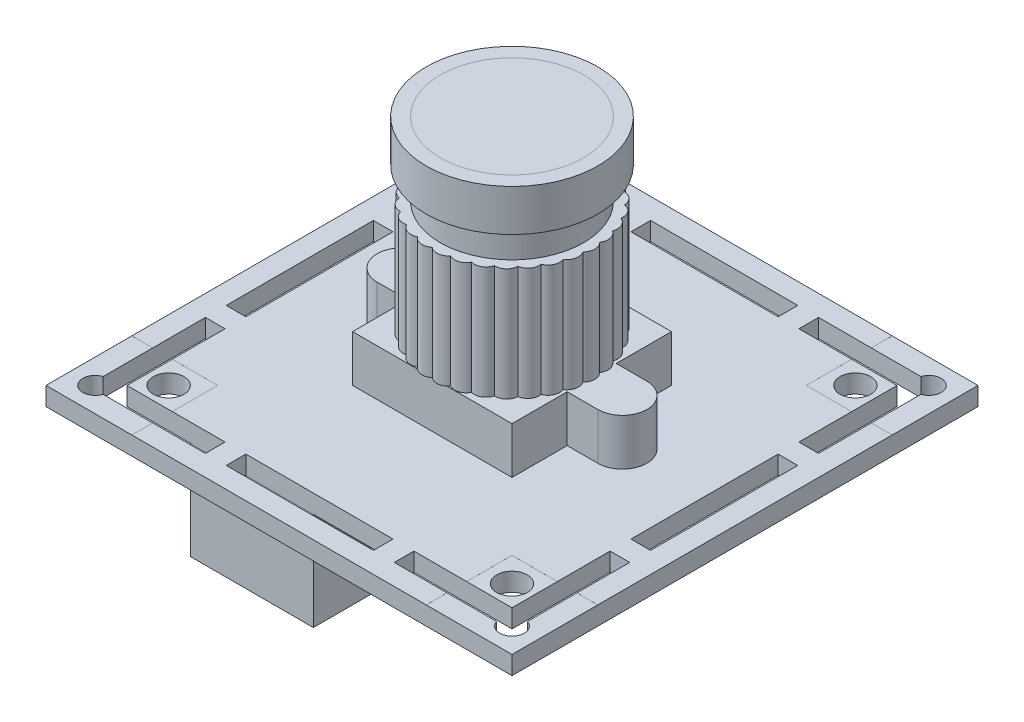
from build123d import *

# Parameters (mm, degrees)
SKETCH_1_W          = 38
SKETCH_1_H          = 38
SKETCH_1_R          = 1.25
SKETCH_1_R_2        = 1
EXTRUDE_1_DEPTH     = 1.5
SKETCH_9_W          = 7
SKETCH_9_H          = 7
CUT_EXTRUDE_2_DEPTH = 0.001
CUT_EXTRUDE_START   = -1.5
SKETCH_9_2_W        = 7
SKETCH_9_2_H        = 7
CUT_EXTRUDE_3_DEPTH = 0.001
CUT_EXTRUDE_1_DEPTH = 27.911893282
EXTRUDE_2_DEPTH     = 3.8
EXTRUDE_3_DEPTH     = 9.2
SKETCH_5_R          = 5.85
EXTRUDE_4_DEPTH     = 6
SKETCH_7_R          = 7
SKETCH_7_R_2        = 5.85
EXTRUDE_5_DEPTH     = 3.4
SKETCH_8_W          = 10
SKETCH_8_H          = 4.7
EXTRUDE_6_DEPTH     = 8


with BuildPart() as part:
    # 草图1 → 凸台-拉伸1 (new body)
    with BuildSketch(Plane(origin=(0, 0, 0), x_dir=(1, 0, 0), z_dir=(0, 1, 0))):
        Rectangle(SKETCH_1_W, SKETCH_1_H)
        with Locations(Location((-14, 14, 0), (0, 0, 270))):
            Circle(SKETCH_1_R, mode=Mode.SUBTRACT)
        with Locations(Location((-14, -14, 0), (0, 0, 270))):
            Circle(SKETCH_1_R, mode=Mode.SUBTRACT)
        with Locations(Location((14, 14, 0), (0, 0, 270))):
            Circle(SKETCH_1_R, mode=Mode.SUBTRACT)
        with Locations(Location((14, -14, 0), (0, 0, 270))):
            Circle(SKETCH_1_R, mode=Mode.SUBTRACT)
        with Locations(Location((-17, 17, 0), (0, 0, 270))):
            Circle(SKETCH_1_R_2, mode=Mode.SUBTRACT)
        with Locations(Location((-17, -17, 0), (0, 0, 270))):
            Circle(SKETCH_1_R_2, mode=Mode.SUBTRACT)
        with Locations(Location((17, -17, 0), (0, 0, 270))):
            Circle(SKETCH_1_R_2, mode=Mode.SUBTRACT)
        with Locations(Location((17, 17, 0), (0, 0, 270))):
            Circle(SKETCH_1_R_2, mode=Mode.SUBTRACT)
    extrude(amount=EXTRUDE_1_DEPTH)

    # 草图9 → 切除-拉伸2 (cut)
    with BuildSketch(Plane(origin=(0, 1.5, 0), x_dir=(1, 0, 0), z_dir=(0, 1, 0))):
        with Locations((15.5, 15.5)):
            Rectangle(SKETCH_9_W, SKETCH_9_H)
        with Locations((-15.5, 15.5)):
            Rectangle(SKETCH_9_W, SKETCH_9_H)
        with Locations((15.5, -15.5)):
            Rectangle(SKETCH_9_W, SKETCH_9_H)
        with Locations((-15.5, -15.5)):
            Rectangle(SKETCH_9_W, SKETCH_9_H)
    extrude(amount=-CUT_EXTRUDE_2_DEPTH, mode=Mode.SUBTRACT)

    # 草图9<2> → 切除-拉伸3 (cut)
    with BuildSketch(Plane(origin=(0, 1.5, 0), x_dir=(1, 0, 0), z_dir=(0, 1, 0)).offset(CUT_EXTRUDE_START)):
        with Locations((15.5, 15.5)):
            Rectangle(SKETCH_9_2_W, SKETCH_9_2_H)
        with Locations((-15.5, 15.5)):
            Rectangle(SKETCH_9_2_W, SKETCH_9_2_H)
        with Locations((15.5, -15.5)):
            Rectangle(SKETCH_9_2_W, SKETCH_9_2_H)
        with Locations((-15.5, -15.5)):
            Rectangle(SKETCH_9_2_W, SKETCH_9_2_H)
    extrude(amount=CUT_EXTRUDE_3_DEPTH, mode=Mode.SUBTRACT)

    # 草图2 → 切除-拉伸1 (cut, through all)
    with BuildSketch(Plane.XZ):
        Polygon((-17.3, 17.3), (-7.7, 17.3), (-7.7, 15.7), (-15.7, 15.7), (-15.7, 7.7), (-17.3, 7.7), align=None)
        Polygon((0, 17.3), (-6, 17.3), (-6, 15.7), (0, 15.7), (6, 15.7), (6, 17.3), align=None)
        Polygon((-15.7, 6), (-15.7, 0), (-15.7, -6), (-17.3, -6), (-17.3, 0), (-17.3, 6), align=None)
        Polygon((15.7, 7.7), (15.7, 15.7), (7.7, 15.7), (7.7, 17.3), (17.3, 17.3), (17.3, 7.7), align=None)
        Polygon((17.3, 6), (15.7, 6), (15.7, 0), (15.7, -6), (17.3, -6), (17.3, 0), align=None)
        Polygon((7.7, -15.7), (15.7, -15.7), (15.7, -7.7), (17.3, -7.7), (17.3, -17.3), (7.7, -17.3), align=None)
        Polygon((6, -17.3), (6, -15.7), (0, -15.7), (-6, -15.7), (-6, -17.3), (0, -17.3), align=None)
        Polygon((-15.7, -7.7), (-15.7, -15.7), (-7.7, -15.7), (-7.7, -17.3), (-17.3, -17.3), (-17.3, -7.7), align=None)
    extrude(amount=-CUT_EXTRUDE_1_DEPTH, mode=Mode.SUBTRACT)

    # 草图3 → 凸台-拉伸2 (add)
    with BuildSketch(Plane(origin=(0, 1.5, 0), x_dir=(1, 0, 0), z_dir=(0, 1, 0))):
        with BuildLine():
            Line((-6.5, 2), (-6.5, 6.5))
            Line((-6.5, 6.5), (6.5, 6.5))
            Line((6.5, 6.5), (6.5, 2))
            Line((6.5, 2), (9, 2))
            ThreePointArc((9, 2), (11, 0), (9, -2))
            Line((9, -2), (6.5, -2))
            Line((6.5, -2), (6.5, -6.5))
            Line((6.5, -6.5), (-6.5, -6.5))
            Line((-6.5, -6.5), (-6.5, -2))
            Line((-6.5, -2), (-9, -2))
            ThreePointArc((-9, -2), (-11, 0), (-9, 2))
            Line((-9, 2), (-6.5, 2))
        make_face()
    extrude(amount=EXTRUDE_2_DEPTH)

    # 草图4 → 凸台-拉伸3 (add)
    with BuildSketch(Plane(origin=(0, 5.3, 0), x_dir=(1, 0, 0), z_dir=(0, 1, 0))):
        with BuildLine():
            ThreePointArc((1.35142599, 6.357959405), (0.705567127, 6.713022794), (0, 6.5))
            ThreePointArc((0, 6.5), (-0.705567127, 6.713022794), (-1.35142599, 6.357959405))
            ThreePointArc((-1.35142599, 6.357959405), (-2.085864712, 6.419631485), (-2.64378818, 5.938045475))
            ThreePointArc((-2.64378818, 5.938045475), (-3.375, 5.845671476), (-3.82060414, 5.258610463))
            ThreePointArc((-3.82060414, 5.258610463), (-4.516631593, 5.016227572), (-4.830441366, 4.349348941))
            ThreePointArc((-4.830441366, 4.349348941), (-5.460864712, 3.967550453), (-5.629165125, 3.25))
            ThreePointArc((-5.629165125, 3.25), (-6.166431839, 2.745472341), (-6.181867356, 2.008610463))
            ThreePointArc((-6.181867356, 2.008610463), (-6.602496305, 1.403403913), (-6.46439232, 0.679435011))
            ThreePointArc((-6.46439232, 0.679435011), (-6.75, 0), (-6.46439232, -0.679435011))
            ThreePointArc((-6.46439232, -0.679435011), (-6.602496305, -1.403403913), (-6.181867356, -2.008610463))
            ThreePointArc((-6.181867356, -2.008610463), (-6.166431839, -2.745472341), (-5.629165125, -3.25))
            ThreePointArc((-5.629165125, -3.25), (-5.460864712, -3.967550453), (-4.830441366, -4.349348941))
            ThreePointArc((-4.830441366, -4.349348941), (-4.516631593, -5.016227572), (-3.82060414, -5.258610463))
            ThreePointArc((-3.82060414, -5.258610463), (-3.375, -5.845671476), (-2.64378818, -5.938045475))
            ThreePointArc((-2.64378818, -5.938045475), (-2.085864712, -6.419631485), (-1.35142599, -6.357959405))
            ThreePointArc((-1.35142599, -6.357959405), (-0.705567127, -6.713022794), (0, -6.5))
            ThreePointArc((0, -6.5), (0.705567127, -6.713022794), (1.35142599, -6.357959405))
            ThreePointArc((1.35142599, -6.357959405), (2.085864712, -6.419631485), (2.64378818, -5.938045475))
            ThreePointArc((2.64378818, -5.938045475), (3.375, -5.845671476), (3.82060414, -5.258610463))
            ThreePointArc((3.82060414, -5.258610463), (4.516631593, -5.016227572), (4.830441366, -4.349348941))
            ThreePointArc((4.830441366, -4.349348941), (5.460864712, -3.967550453), (5.629165125, -3.25))
            ThreePointArc((5.629165125, -3.25), (6.166431839, -2.745472341), (6.181867356, -2.008610463))
            ThreePointArc((6.181867356, -2.008610463), (6.602496305, -1.403403913), (6.46439232, -0.679435011))
            ThreePointArc((6.46439232, -0.679435011), (6.75, 0), (6.46439232, 0.679435011))
            ThreePointArc((6.46439232, 0.679435011), (6.602496305, 1.403403913), (6.181867356, 2.008610463))
            ThreePointArc((6.181867356, 2.008610463), (6.166431839, 2.745472341), (5.629165125, 3.25))
            ThreePointArc((5.629165125, 3.25), (5.460864712, 3.967550453), (4.830441366, 4.349348941))
            ThreePointArc((4.830441366, 4.349348941), (4.516631593, 5.016227572), (3.82060414, 5.258610463))
            ThreePointArc((3.82060414, 5.258610463), (3.375, 5.845671476), (2.64378818, 5.938045475))
            ThreePointArc((2.64378818, 5.938045475), (2.085864712, 6.419631485), (1.35142599, 6.357959405))
        make_face()
    extrude(amount=EXTRUDE_3_DEPTH)

    # 草图5 → 凸台-拉伸4 (add)
    with BuildSketch(Plane(origin=(0, 14.5, 0), x_dir=(1, 0, 0), z_dir=(0, 1, 0))):
        with Locations(Location((0, 0, 0), (0, 0, 270))):
            Circle(SKETCH_5_R)
    extrude(amount=EXTRUDE_4_DEPTH)


with BuildPart() as body_2:
    # 草图7 → 凸台-拉伸5 (new body)
    with BuildSketch(Plane(origin=(0, 20.5, 0), x_dir=(1, 0, 0), z_dir=(0, 1, 0))):
        with Locations(Location((0, 0, 0), (0, 0, 270))):
            Circle(SKETCH_7_R)
        with Locations(Location((0, 0, 0), (0, 0, 270))):
            Circle(SKETCH_7_R_2, mode=Mode.SUBTRACT)
    extrude(amount=-EXTRUDE_5_DEPTH)


with BuildPart() as body_3:
    # 草图8 → 凸台-拉伸6 (new body)
    with BuildSketch(Plane.XZ):
        with Locations((-5.5, 13.35)):
            Rectangle(SKETCH_8_W, SKETCH_8_H)
    extrude(amount=EXTRUDE_6_DEPTH)


solid = Compound([part.part, body_2.part, body_3.part])
